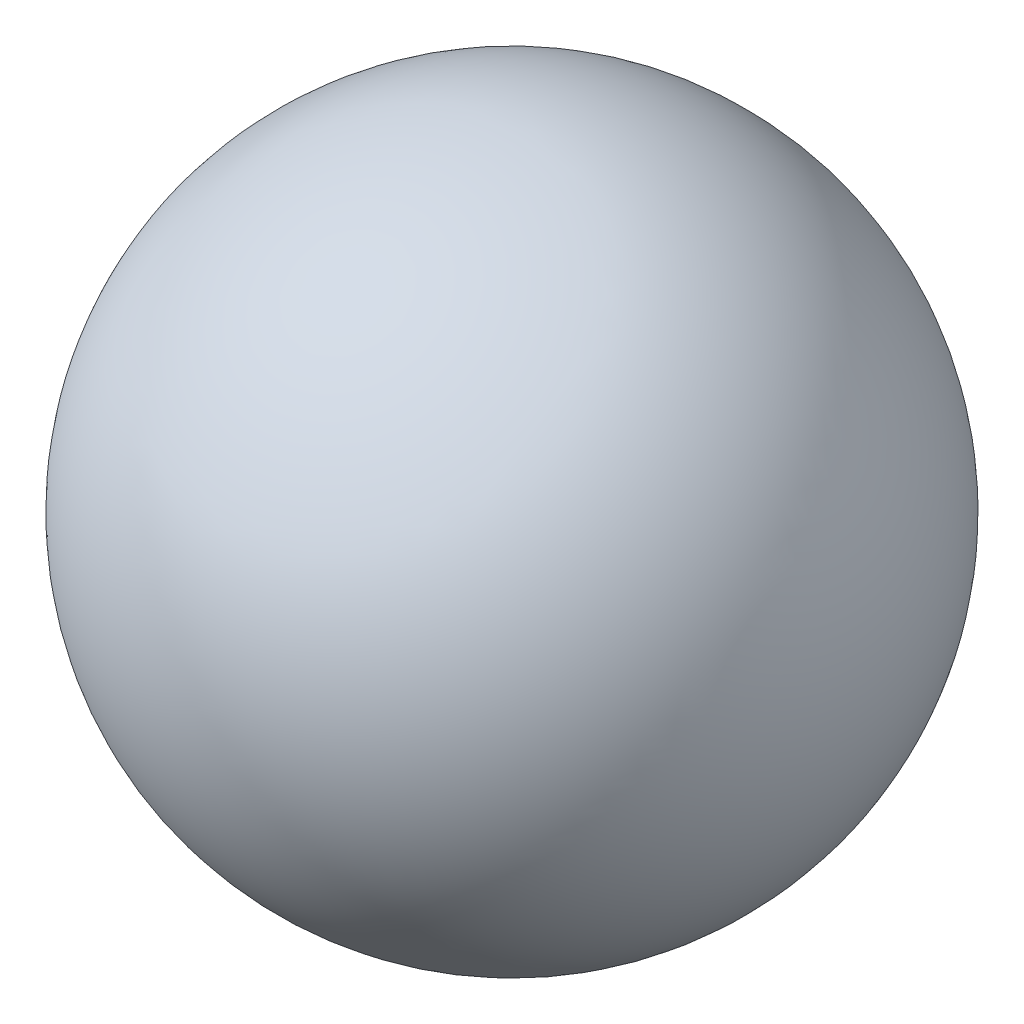
from build123d import *


with BuildPart() as part:
    # Sketch1 one side → Revolve-Thin1 (revolve)
    with BuildSketch(Plane.XY):
        with BuildLine():
            Line((-12, 0), (-14.54, 0))
            ThreePointArc((-14.54, 0), (0, -14.54), (14.54, 0))
            Line((14.54, 0), (12, 0))
            ThreePointArc((12, 0), (0, -12), (-12, 0))
        make_face()
    revolve(axis=Axis((-12, 0, 0), (1, 0, 0)))


solid = part.part
